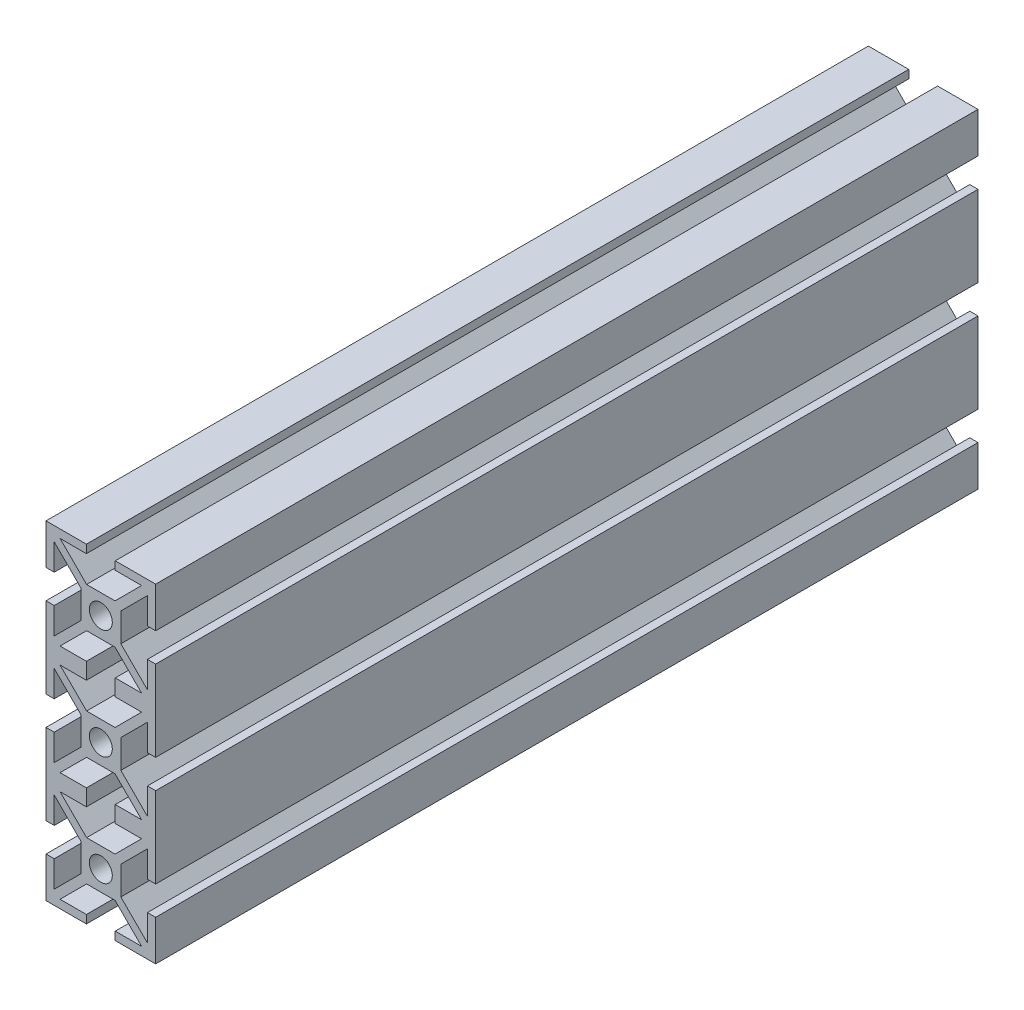
from build123d import *

# Parameters (mm, degrees)
SKETCH1_R           = 2.095
BOSS_EXTRUDE1_DEPTH = 150
LPATTERN1_COUNT     = 3
LPATTERN1_PITCH     = 20


with BuildPart() as part:
    # Sketch1 → Boss-Extrude1 (new body)
    with BuildSketch(Plane.XY):
        Polygon((6.345, 12.594339828), (1.5, 17.439339828), (1.5, 12.63), (0, 12.63), (0, 20), (7.37, 20), (7.37, 18.5), (2.560660172, 18.5), (7.405660172, 13.655), (12.594339828, 13.655), (17.439339828, 18.5), (12.63, 18.5), (12.63, 20), (20, 20), (20, 12.63), (18.5, 12.63), (18.5, 17.439339828), (13.655, 12.594339828), (13.655, 7.405660172), (18.5, 2.560660172), (18.5, 7.37), (20, 7.37), (20, 0), (12.63, 0), (12.63, 1.5), (17.439339828, 1.5), (12.594339828, 6.345), (7.405660172, 6.345), (2.560660172, 1.5), (7.37, 1.5), (7.37, 0), (0, 0), (0, 7.37), (1.5, 7.37), (1.5, 2.560660172), (6.345, 7.405660172), align=None)
        with Locations((10, 10)):
            Circle(SKETCH1_R, mode=Mode.SUBTRACT)
    boss_extrude1 = extrude(amount=BOSS_EXTRUDE1_DEPTH)

    # LPattern1: Boss-Extrude1 ×3
    with Locations(*[(0, -i * LPATTERN1_PITCH, 0) for i in range(1, LPATTERN1_COUNT)]):
        add(boss_extrude1)


solid = part.part
